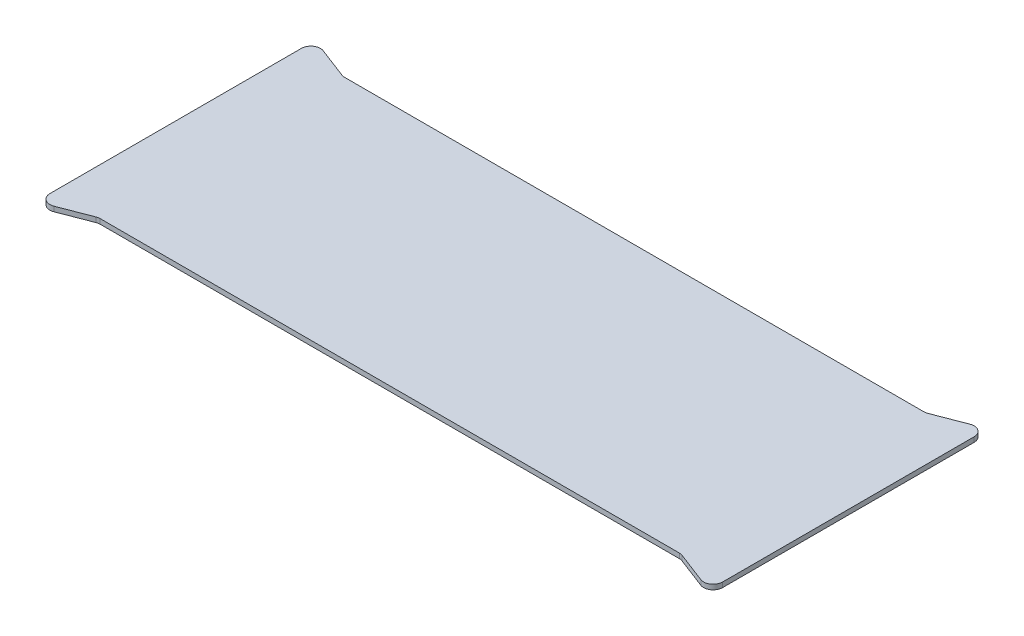
from build123d import *

# Parameters (mm, degrees)
SKETCH1_W           = 412.75
SKETCH1_H           = 158.75
SKETCH1_R           = 6.191295591
BOSS_EXTRUDE1_DEPTH = 3.175
FILLET1_R           = 6.35


with BuildPart() as part:
    # Sketch1 → Boss-Extrude1 (new body)
    with BuildSketch(Plane(origin=(0, 0, 0), x_dir=(1, 0, 0), z_dir=(0, 1, 0))):
        with Locations((206.375, 79.375)):
            Rectangle(SKETCH1_W, SKETCH1_H)
        with Locations((418.528618537, 160.972545591)):
            Circle(SKETCH1_R)
        with BuildLine():
            Line((416.306072946, 166.751164128), (395.503046214, 158.75))
            Line((395.503046214, 158.75), (412.75, 158.75))
            ThreePointArc((412.75, 158.75), (412.870941125, 163.487068885), (416.306072946, 166.751164128))
        make_face()
        with BuildLine():
            Line((412.75, 158.75), (412.75, 0))
            ThreePointArc((412.75, 0), (419.658885237, 3.864706522), (424.719914128, -2.222545591))
            Line((424.719914128, -2.222545591), (424.719914128, 160.972545591))
            ThreePointArc((424.719914128, 160.972545591), (419.658885237, 154.885293478), (412.75, 158.75))
        make_face()
        with BuildLine():
            Line((412.75, 0), (395.503046214, 0))
            Line((395.503046214, 0), (416.306072946, -8.001164128))
            ThreePointArc((416.306072946, -8.001164128), (412.870941125, -4.737068885), (412.75, 0))
        make_face()
        with Locations((418.528618537, -2.222545591)):
            Circle(SKETCH1_R)
        with Locations((-5.778618537, 160.972545591)):
            Circle(SKETCH1_R)
        with BuildLine():
            ThreePointArc((0.412677054, 160.972545591), (0.308633576, 159.842278891), (0, 158.75))
            Line((0, 158.75), (17.246953786, 158.75))
            Line((17.246953786, 158.75), (-3.556072946, 166.751164128))
            ThreePointArc((-3.556072946, 166.751164128), (-0.675062041, 164.47766359), (0.412677054, 160.972545591))
        make_face()
        with BuildLine():
            ThreePointArc((-11.969914128, -2.222545591), (-6.908885237, 3.864706522), (0, 0))
            Line((0, 0), (0, 158.75))
            ThreePointArc((0, 158.75), (-6.908885237, 154.885293478), (-11.969914128, 160.972545591))
            Line((-11.969914128, 160.972545591), (-11.969914128, -2.222545591))
        make_face()
        with Locations((-5.778618537, -2.222545591)):
            Circle(SKETCH1_R)
        with BuildLine():
            Line((17.246953786, 0), (0, 0))
            ThreePointArc((0, 0), (0.308633576, -1.092278891), (0.412677054, -2.222545591))
            ThreePointArc((0.412677054, -2.222545591), (-0.675062041, -5.72766359), (-3.556072946, -8.001164128))
            Line((-3.556072946, -8.001164128), (17.246953786, 0))
        make_face()
    extrude(amount=BOSS_EXTRUDE1_DEPTH)

    # Fillet1
    fillet1_edges = [part.edges().sort_by_distance(p)[0] for p in [
        (17.246953786, 1.5875, -158.75),
        (395.503046214, 1.5875, -158.75),
        (395.503046214, 1.5875, 0),
        (17.246953786, 1.5875, 0),
    ]]
    fillet(fillet1_edges, radius=FILLET1_R)


solid = part.part
